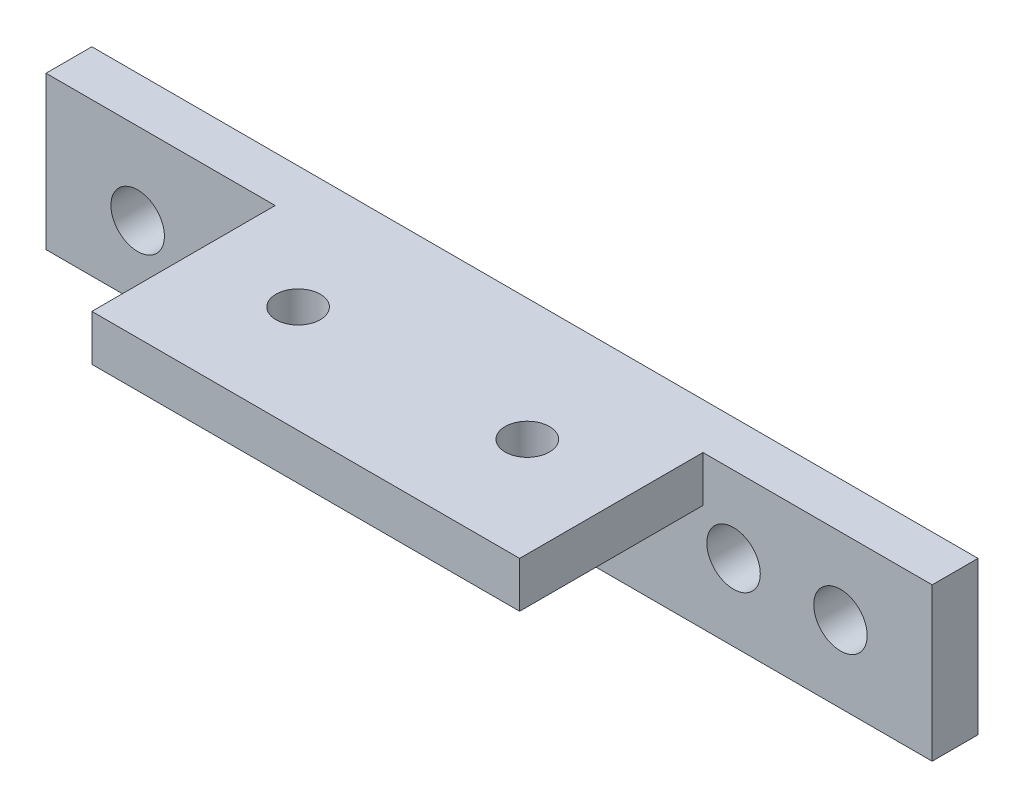
from build123d import *

# Parameters (mm, degrees)
SKETCH1_W           = 28
SKETCH1_H           = 12
SKETCH1_R           = 1.45
BOSS_EXTRUDE1_DEPTH = 3
SKETCH2_W           = 58
SKETCH2_H           = 3
BOSS_EXTRUDE2_DEPTH = 10
SKETCH3_R           = 1.75
CUT_EXTRUDE1_DEPTH  = 12


with BuildPart() as part:
    # Sketch1 → Boss-Extrude1 (new body)
    with BuildSketch(Plane(origin=(0, 0, 0), x_dir=(1, 0, 0), z_dir=(0, 1, 0))):
        with Locations((14, -6)):
            Rectangle(SKETCH1_W, SKETCH1_H)
        with Locations(Location((6.5, -5, 0), (0, 0, 270))):
            Circle(SKETCH1_R, mode=Mode.SUBTRACT)
        with Locations(Location((21.5, -5, 0), (0, 0, 270))):
            Circle(SKETCH1_R, mode=Mode.SUBTRACT)
    extrude(amount=BOSS_EXTRUDE1_DEPTH)

    # Sketch2 → Boss-Extrude2 (add)
    with BuildSketch(Plane(origin=(0, 3, 0), x_dir=(1, 0, 0), z_dir=(0, 1, 0))):
        with Locations((14, 1.5)):
            Rectangle(SKETCH2_W, SKETCH2_H)
    extrude(amount=-BOSS_EXTRUDE2_DEPTH)

    # Sketch3 → Cut-Extrude1 (cut)
    with BuildSketch(Plane(origin=(0, 0, -3), x_dir=(-1, 0, 0), z_dir=(0, 0, -1))):
        with Locations((9, -2.359486917)):
            Circle(SKETCH3_R)
        with Locations((-36.998595295, -2)):
            Circle(SKETCH3_R)
        with Locations((2, -2)):
            Circle(SKETCH3_R)
        with Locations((-30, -2)):
            Circle(SKETCH3_R)
    extrude(amount=-CUT_EXTRUDE1_DEPTH, mode=Mode.SUBTRACT)


solid = part.part
